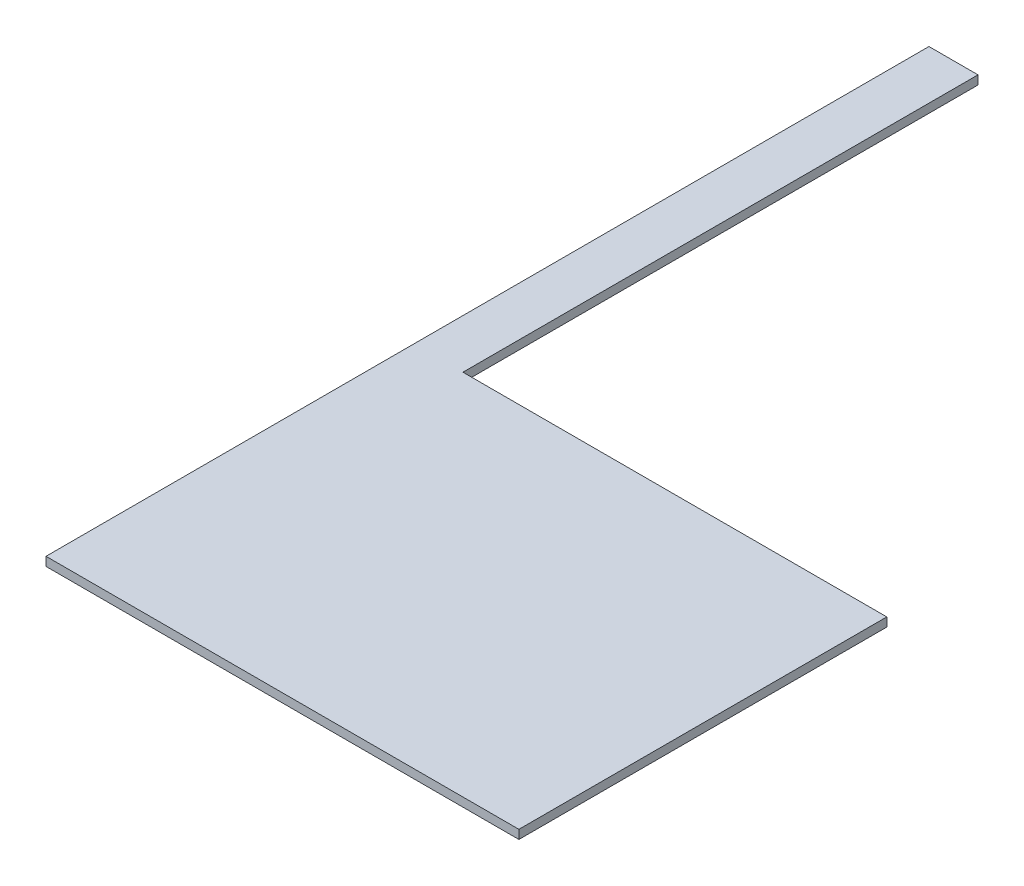
from build123d import *

# Parameters (mm, degrees)
BOSS_EXTRUDE1_DEPTH = 18.25625


with BuildPart() as part:
    # Sketch1 → Boss-Extrude1 (new body)
    with BuildSketch(Plane(origin=(0, 0, 0), x_dir=(1, 0, 0), z_dir=(0, 1, 0))):
        Polygon((-489.74375, 381), (-489.74375, 1447.8), (-388.14375, 1447.8), (-388.14375, 381), (489.74375, 381), (489.74375, -381), (-489.74375, -381), align=None)
    extrude(amount=BOSS_EXTRUDE1_DEPTH)


solid = part.part
